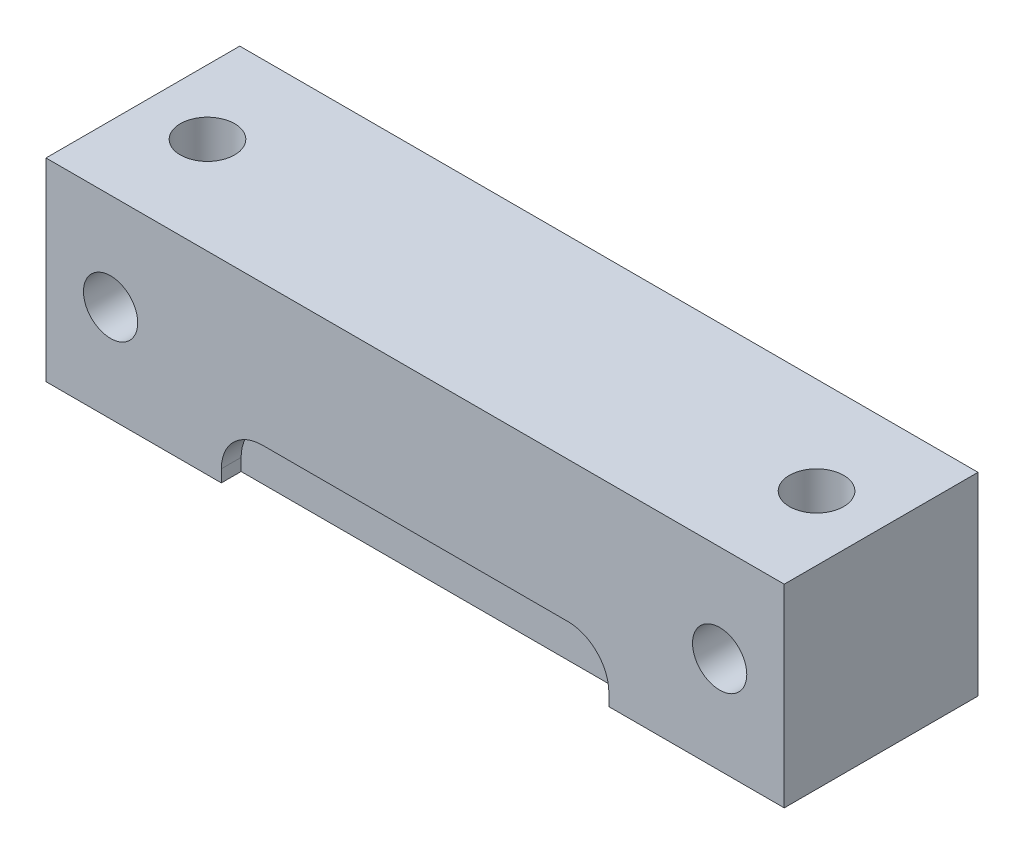
from build123d import *

# Parameters (mm, degrees)
SKETCH1_W             = 15
SKETCH1_H             = 15
BOSS_EXTRUDE1_DEPTH   = 57.15
M5X0_8_TAPPED_HOLE1_D = 4.2
M5X0_8_TAPPED_HOLE2_D = 4.2
SKETCH12_W            = 30
SKETCH12_H            = 8.246203466
CUT_EXTRUDE2_DEPTH    = 1.53
FILLET2_R             = 3.175


with BuildPart() as part:
    # Sketch1 → Boss-Extrude1 (new body)
    with BuildSketch(Plane(origin=(0, 0, 0), x_dir=(0, 0, -1), z_dir=(1, 0, 0))):
        Rectangle(SKETCH1_W, SKETCH1_H)
    extrude(amount=BOSS_EXTRUDE1_DEPTH)

    # M5x0.8 Tapped Hole1 (through all)
    with Locations(Plane.XY.offset(7.5)):
        with Locations((5, 0), (52.15, 0)):
            Hole(M5X0_8_TAPPED_HOLE1_D / 2)

    # M5x0.8 Tapped Hole2 (through all)
    with Locations(Plane(origin=(0, -7.5, 0), x_dir=(-1, 0, 0), z_dir=(0, -1, 0))):
        with Locations((-5, 0), (-52.15, 0)):
            Hole(M5X0_8_TAPPED_HOLE2_D / 2)

    # Sketch12 → Cut-Extrude2 (cut)
    with BuildSketch(Plane.XY.offset(7.5)):
        with Locations((28.575, -7.5)):
            Rectangle(SKETCH12_W, SKETCH12_H)
    extrude(amount=-CUT_EXTRUDE2_DEPTH, mode=Mode.SUBTRACT)

    # Fillet2
    fillet2_edges = [part.edges().sort_by_distance(p)[0] for p in [
        (43.575, -3.376898267, 6.735),
        (13.575, -3.376898267, 6.735),
    ]]
    fillet(fillet2_edges, radius=FILLET2_R)


solid = part.part
